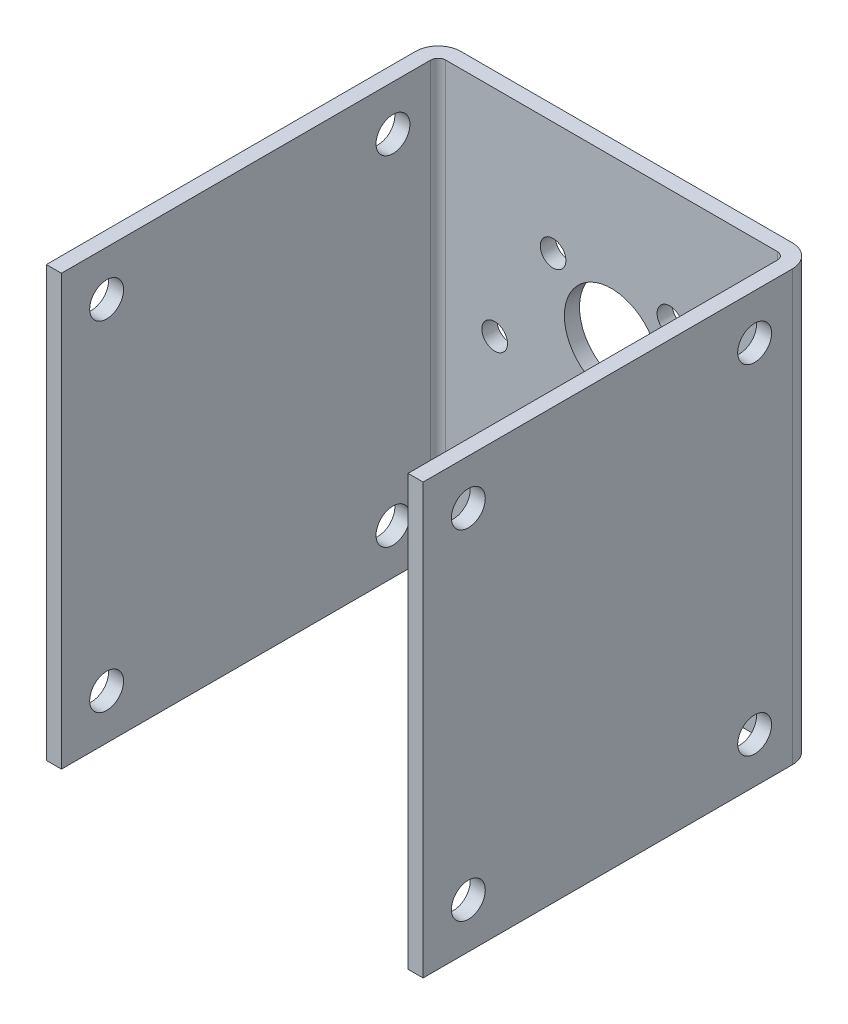
from build123d import *

# Parameters (mm, degrees)
BOSS_EXTRUDE1_DEPTH = 57
SKETCH2_R           = 2.25
CUT_EXTRUDE1_DEPTH  = 92.940197955
SKETCH3_R           = 1.7
SKETCH3_R_2         = 6.25
CUT_EXTRUDE2_DEPTH  = 52


with BuildPart() as part:
    # Sketch1 → Boss-Extrude1 (new body)
    with BuildSketch(Plane(origin=(0, 0, 0), x_dir=(1, 0, 0), z_dir=(0, 1, 0))):
        with BuildLine():
            Line((-2, 0), (-2, 49))
            ThreePointArc((-2, 49), (-1.121320344, 51.121320344), (1, 52))
            Line((1, 52), (45, 52))
            ThreePointArc((45, 52), (47.121320344, 51.121320344), (48, 49))
            Line((48, 49), (48, 0))
            Line((48, 0), (46, 0))
            Line((46, 0), (46, 49))
            ThreePointArc((46, 49), (45.707106781, 49.707106781), (45, 50))
            Line((45, 50), (1, 50))
            ThreePointArc((1, 50), (0.292893219, 49.707106781), (0, 49))
            Line((0, 49), (0, 0))
            Line((0, 0), (-2, 0))
        make_face()
    extrude(amount=BOSS_EXTRUDE1_DEPTH)

    # Sketch2 → Cut-Extrude1 (cut, through all)
    with BuildSketch(Plane(origin=(48, 0, 0), x_dir=(0, 0, -1), z_dir=(1, 0, 0))):
        with Locations((6, 51)):
            Circle(SKETCH2_R)
        with Locations((44, 51)):
            Circle(SKETCH2_R)
        with Locations((6, 6)):
            Circle(SKETCH2_R)
        with Locations((44, 6)):
            Circle(SKETCH2_R)
    extrude(amount=-CUT_EXTRUDE1_DEPTH, mode=Mode.SUBTRACT)

    # Sketch3 → Cut-Extrude2 (cut)
    with BuildSketch(Plane(origin=(0, 0, -52), x_dir=(-1, 0, 0), z_dir=(0, 0, -1))):
        with Locations((-38.5, 28.5)):
            Circle(SKETCH3_R)
        with Locations((-30.75, 41.923393759)):
            Circle(SKETCH3_R)
        with Locations((-15.25, 41.923393759)):
            Circle(SKETCH3_R)
        with Locations((-7.5, 28.5)):
            Circle(SKETCH3_R)
        with Locations((-15.25, 15.076606241)):
            Circle(SKETCH3_R)
        with Locations((-30.75, 15.076606241)):
            Circle(SKETCH3_R)
        with Locations((-23, 35.5)):
            Circle(SKETCH3_R_2)
    extrude(amount=-CUT_EXTRUDE2_DEPTH, mode=Mode.SUBTRACT)


solid = part.part
